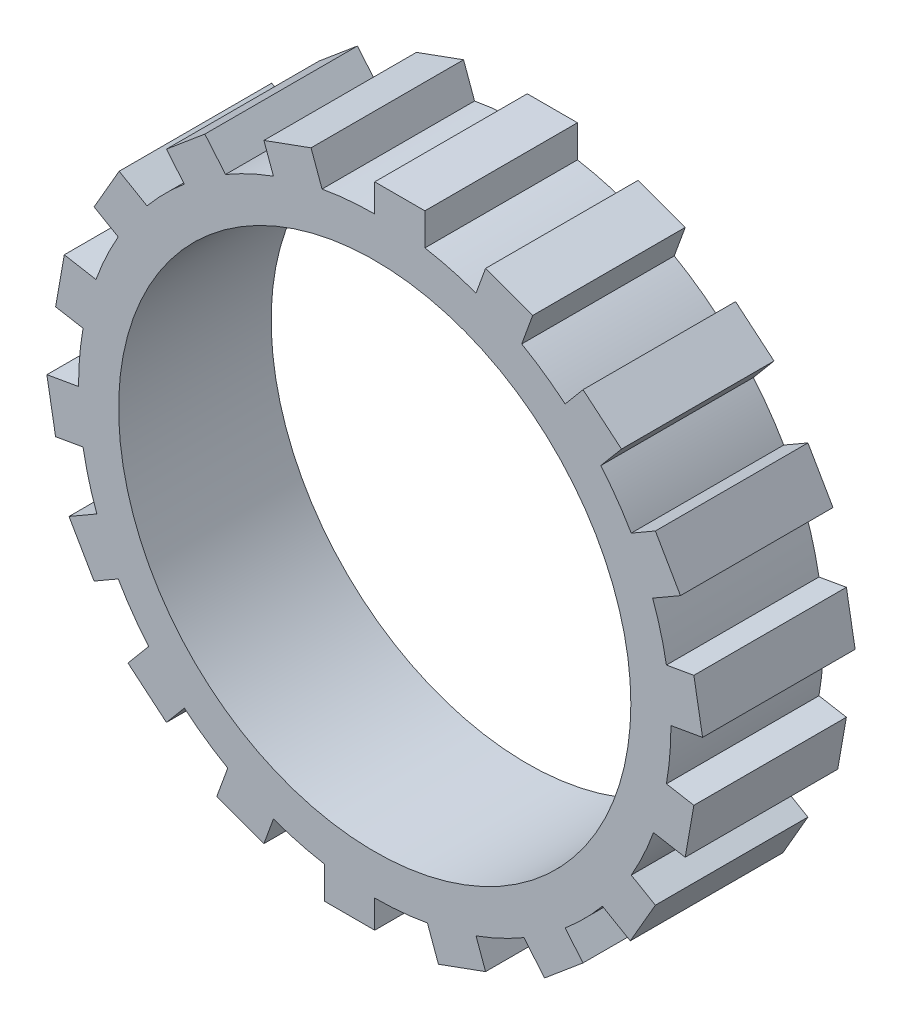
from build123d import *

# Parameters (mm, degrees)
SKETCH1_R           = 8.5
SKETCH1_R_2         = 7.35
BOSS_EXTRUDE3_DEPTH = 8.755
BOSS_EXTRUDE5_START = -0.3
SKETCH3_W           = 1.43994518
SKETCH3_H           = 4.3775
BOSS_EXTRUDE5_DEPTH = 1.1
CIRPATTERN1_COUNT   = 18
SKETCH6_R           = 8.5
CUT_EXTRUDE1_DEPTH  = 4.3775


with BuildPart() as part:
    # Sketch1 → Boss-Extrude3 (new body)
    with BuildSketch(Plane.XY):
        Circle(SKETCH1_R)
        Circle(SKETCH1_R_2, mode=Mode.SUBTRACT)
    extrude(amount=BOSS_EXTRUDE3_DEPTH)

    # Sketch3 → Boss-Extrude5 (add)
    with BuildSketch(Plane(origin=(0, 8.5, 0), x_dir=(1, 0, 0), z_dir=(0, 1, 0)).offset(BOSS_EXTRUDE5_START)):
        with Locations((0.71997259, -6.56625)):
            Rectangle(SKETCH3_W, SKETCH3_H)
    boss_extrude5 = extrude(amount=BOSS_EXTRUDE5_DEPTH)

    # CirPattern1: Boss-Extrude5 ×18 about axis
    cirpattern1_axis = Axis((0, 0, 0), (0, 0, 1))
    for i in range(1, CIRPATTERN1_COUNT):
        add(boss_extrude5.rotate(cirpattern1_axis, i * 360 / CIRPATTERN1_COUNT))

    # Sketch6 → Cut-Extrude1 (cut)
    with BuildSketch(Plane(origin=(0, 0, 0), x_dir=(-1, 0, 0), z_dir=(0, 0, -1))):
        Circle(SKETCH6_R)
    extrude(amount=-CUT_EXTRUDE1_DEPTH, mode=Mode.SUBTRACT)


solid = part.part
